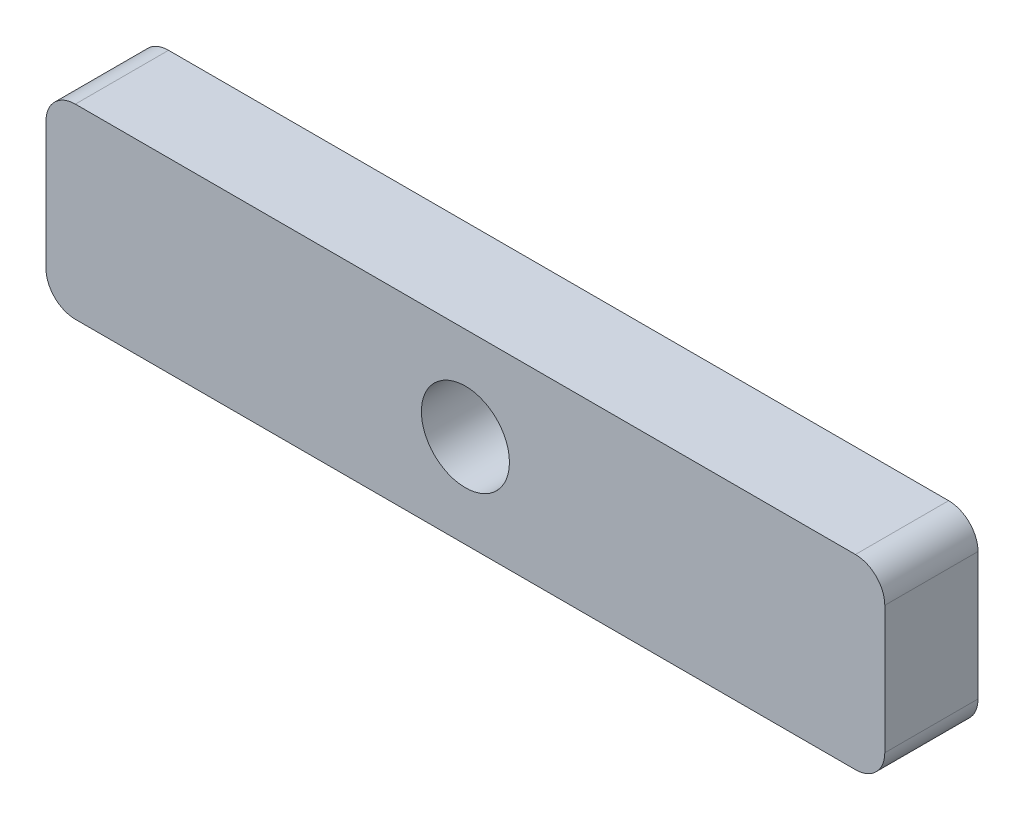
from build123d import *

# Parameters (mm, degrees)
SKETCH1_W           = 57.15
SKETCH1_H           = 12.7
SKETCH1_R           = 3
BOSS_EXTRUDE1_DEPTH = 6.35
FILLET1_R           = 2


with BuildPart() as part:
    # Sketch1 → Boss-Extrude1 (new body)
    with BuildSketch(Plane.XY):
        Rectangle(SKETCH1_W, SKETCH1_H)
        Circle(SKETCH1_R, mode=Mode.SUBTRACT)
    extrude(amount=BOSS_EXTRUDE1_DEPTH)

    # Fillet1
    fillet1_edges = [part.edges().sort_by_distance(p)[0] for p in [
        (28.575, -6.35, 3.175),
        (-28.575, -6.35, 3.175),
        (-28.575, 6.35, 3.175),
        (28.575, 6.35, 3.175),
    ]]
    fillet(fillet1_edges, radius=FILLET1_R)


solid = part.part
